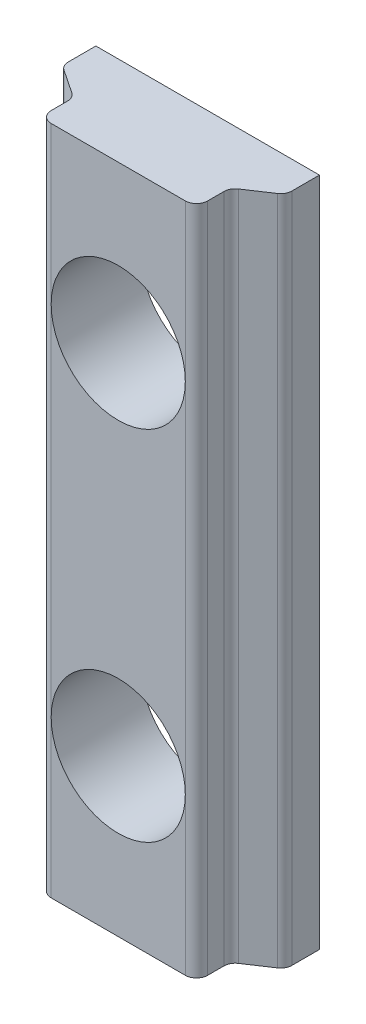
from build123d import *

# Parameters (mm, degrees)
EXTRUDE_1_DEPTH     = 30
FILLET_1_R          = 0.5
SKETCH_2_R          = 3
CUT_EXTRUDE_1_DEPTH = 30


with BuildPart() as part:
    # Эскиз1 → Бобышка-Вытянуть1 (new body)
    with BuildSketch(Plane(origin=(0, 0, 0), x_dir=(1, 0, 0), z_dir=(0, 1, 0))):
        Polygon((-5, 0), (5, 0), (5, -1.5), (3.5, -2.5), (3.5, -4), (-3.5, -4), (-3.5, -2.5), (-5, -1.5), align=None)
    extrude(amount=EXTRUDE_1_DEPTH)

    # Скругление1
    fillet_1_edges = [part.edges().sort_by_distance(p)[0] for p in [
        (5, 15, 1.5),
        (3.5, 15, 2.5),
        (3.5, 15, 4),
        (-3.5, 15, 4),
        (-3.5, 15, 2.5),
        (-5, 15, 1.5),
    ]]
    fillet(fillet_1_edges, radius=FILLET_1_R)

    # Эскиз2 → Вырез-Вытянуть1 (cut)
    with BuildSketch(Plane.XY.offset(4)):
        with Locations((0, 23)):
            Circle(SKETCH_2_R)
        with Locations((0, 7)):
            Circle(SKETCH_2_R)
    extrude(amount=-CUT_EXTRUDE_1_DEPTH, mode=Mode.SUBTRACT)


solid = part.part
